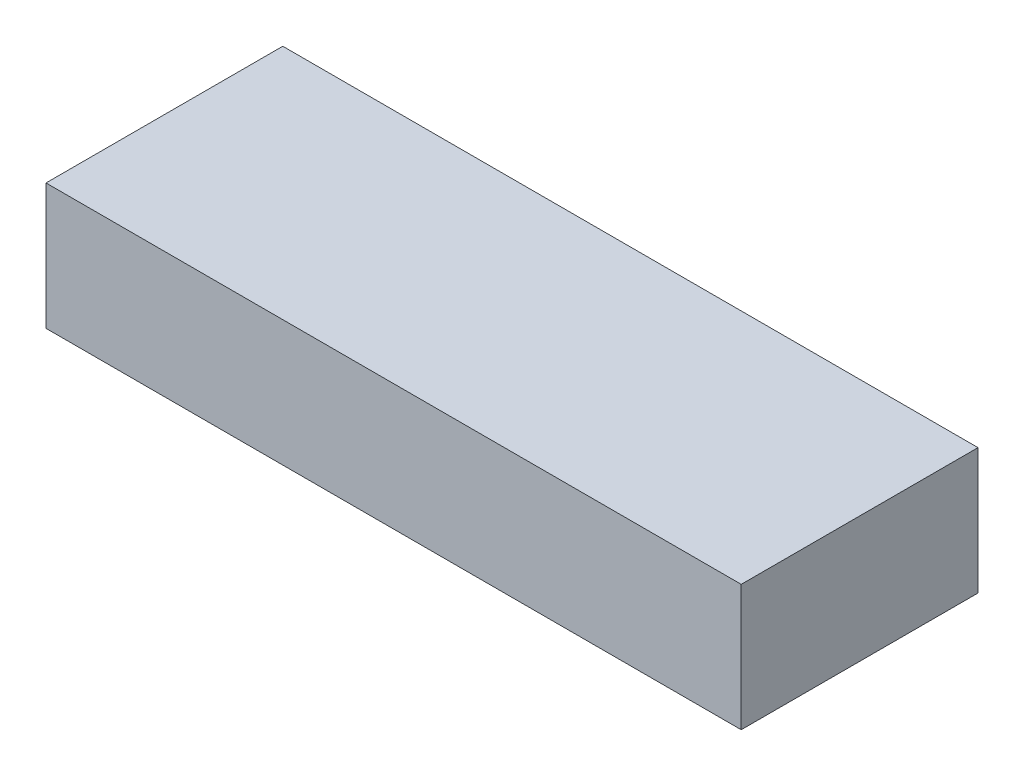
from build123d import *

# Parameters (mm, degrees)
SKETCH1_W           = 138
SKETCH1_H           = 47
BOSS_EXTRUDE1_DEPTH = 25


with BuildPart() as part:
    # Sketch1 → Boss-Extrude1 (new body)
    with BuildSketch(Plane(origin=(0, 0, 0), x_dir=(1, 0, 0), z_dir=(0, 1, 0))):
        with Locations((69, 23.5)):
            Rectangle(SKETCH1_W, SKETCH1_H)
    extrude(amount=BOSS_EXTRUDE1_DEPTH)


solid = part.part
